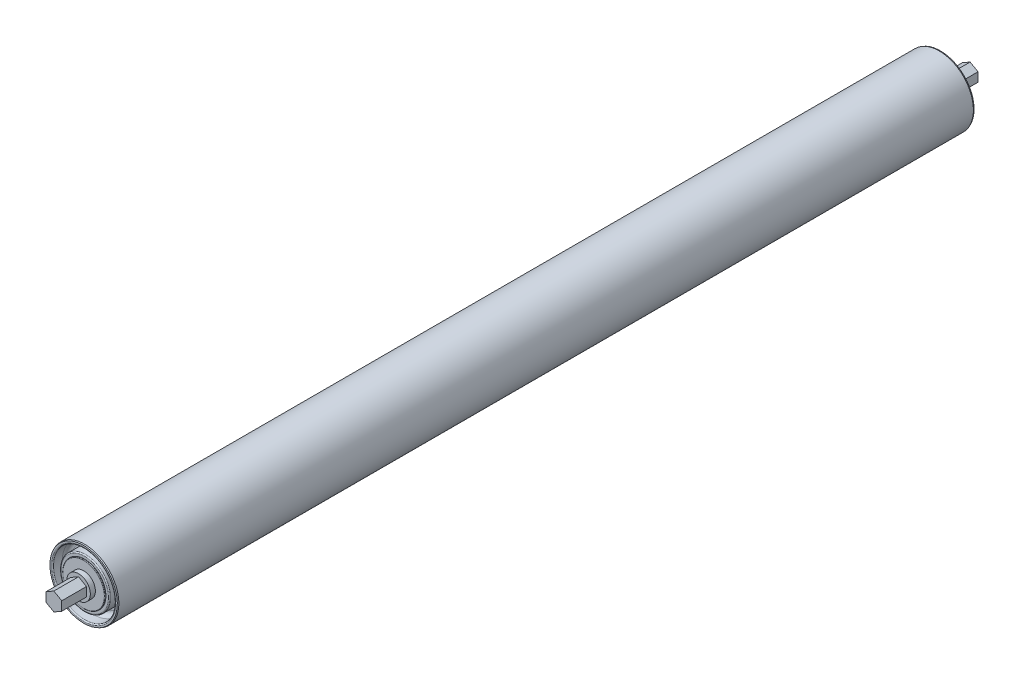
from build123d import *

# Parameters (mm, degrees)
BOSS_EXTRUDE1_REACH = 650.598


with BuildPart() as part:
    # Sketch3 → Revolve1 (revolve)
    with BuildSketch(Plane(origin=(0, 0, 0), x_dir=(0, 0, -1), z_dir=(1, 0, 0)), mode=Mode.PRIVATE) as revolve1_sk:
        Polygon((323.85, 5.55625), (306.3875, 5.55625), (306.3875, 8.334375), (302.815625, 8.334375), (302.815625, 23.8125), (302.021875, 24.13), (-302.021875, 24.13), (-302.815625, 23.8125), (-302.815625, 8.334375), (-306.3875, 8.334375), (-306.3875, 5.55625), (-323.85, 5.55625), (-323.85, 0), (323.85, 0), align=None)
    revolve(revolve1_sk.sketch.rotate(Axis((0, 0, 323.85), (0, 0, -1)), 180), axis=Axis((0, 0, 323.85), (0, 0, -1)))

    # Boss-Extrude1: up to this face of the body (flat: up to its plane)
    boss_extrude1_end = Plane(part.part.faces().sort_by_distance((0, 0, -323.85))[0])
    # Sketch4 → Boss-Extrude1 (add, up to the picked face)
    with BuildSketch(Plane.XY.offset(323.85), mode=Mode.PRIVATE) as boss_extrude1_sk1:
        Polygon((0, 6.415804866), (-5.55625, 3.207902433), (-5.55625, -3.207902433), (0, -6.415804866), (5.55625, -3.207902433), (5.55625, 3.207902433), align=None)
    boss_extrude1_tool1 = split(extrude(boss_extrude1_sk1.sketch, amount=-BOSS_EXTRUDE1_REACH, mode=Mode.PRIVATE), bisect_by=boss_extrude1_end, keep=Keep.BOTH, mode=Mode.PRIVATE)
    add(boss_extrude1_tool1.solids().sort_by(Axis((0, 0, 323.85), (0, 0, -1)))[0])

    # Sketch6 → Cut-Revolve1 (revolve, cut)
    with BuildSketch(Plane(origin=(0, 0, 0), x_dir=(0, 0, -1), z_dir=(1, 0, 0)), mode=Mode.PRIVATE) as cut_revolve1_sk:
        with BuildLine():
            Line((-295.94175, 21.971), (-302.053625, 21.971))
            ThreePointArc((-302.053625, 21.971), (-302.592440367, 22.194184633), (-302.815625, 22.733))
            Line((-302.815625, 22.733), (-302.815625, 14.620875))
            ThreePointArc((-302.815625, 14.620875), (-302.704032684, 14.890282684), (-302.434625, 15.001875))
            Line((-302.434625, 15.001875), (-302.053625, 15.001875))
            Line((-302.053625, 15.001875), (-302.053625, 16.7401875))
            ThreePointArc((-302.053625, 16.7401875), (-301.830440367, 17.279002867), (-301.291625, 17.5021875))
            Line((-301.291625, 17.5021875), (-292.89375, 17.5021875))
            Line((-292.89375, 17.5021875), (-292.89375, 18.923))
            ThreePointArc((-292.89375, 18.923), (-293.786488531, 21.078261469), (-295.94175, 21.971))
        make_face()
    cut_revolve1 = revolve(cut_revolve1_sk.sketch.rotate(Axis((0, 0, 323.85), (0, 0, -1)), 180), axis=Axis((0, 0, 323.85), (0, 0, -1)), mode=Mode.SUBTRACT)

    # Mirror2: Cut-Revolve1 across plane
    add(cut_revolve1.mirror(Plane.XY), mode=Mode.SUBTRACT)


solid = part.part
